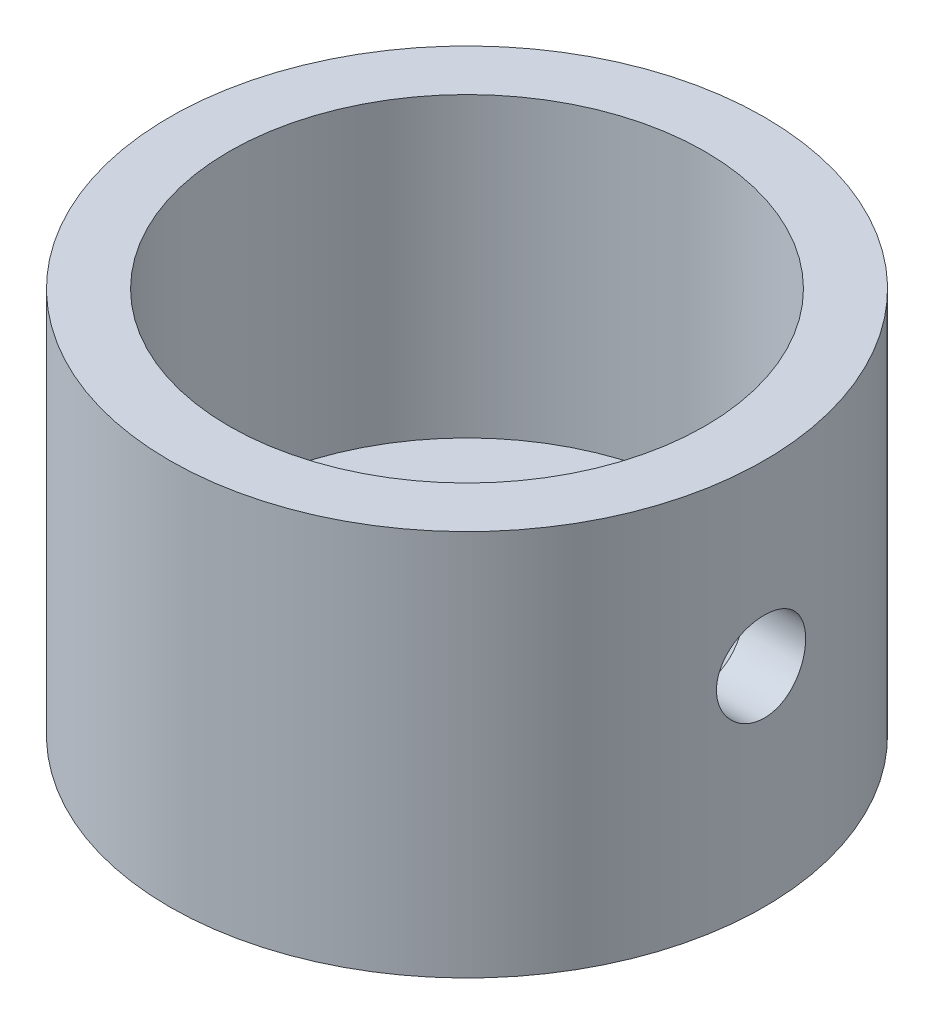
from build123d import *

# Parameters (mm, degrees)
SKETCH1_R           = 10
BOSS_EXTRUDE1_DEPTH = 3
SKETCH2_R           = 1.75
CUT_EXTRUDE1_DEPTH  = 3
SKETCH3_R           = 10
SKETCH3_R_2         = 8
BOSS_EXTRUDE2_DEPTH = 10
SKETCH4_R           = 1.5
CUT_EXTRUDE2_DEPTH  = 5


with BuildPart() as part:
    # Sketch1 → Boss-Extrude1 (new body)
    with BuildSketch(Plane(origin=(0, 0, 0), x_dir=(1, 0, 0), z_dir=(0, 1, 0))):
        with Locations(Location((0, 0, 0), (0, 0, 270))):
            Circle(SKETCH1_R)
    extrude(amount=BOSS_EXTRUDE1_DEPTH)

    # Sketch2 → Cut-Extrude1 (cut)
    with BuildSketch(Plane(origin=(0, 3, 0), x_dir=(1, 0, 0), z_dir=(0, 1, 0))):
        with Locations(Location((0, 0, 0), (0, 0, 270))):
            Circle(SKETCH2_R)
    extrude(amount=-CUT_EXTRUDE1_DEPTH, mode=Mode.SUBTRACT)

    # Sketch3 → Boss-Extrude2 (add)
    with BuildSketch(Plane(origin=(0, 3, 0), x_dir=(1, 0, 0), z_dir=(0, 1, 0))):
        with Locations(Location((0, 0, 0), (0, 0, 270))):
            Circle(SKETCH3_R)
        with Locations(Location((0, 0, 0), (0, 0, 270))):
            Circle(SKETCH3_R_2, mode=Mode.SUBTRACT)
    extrude(amount=BOSS_EXTRUDE2_DEPTH)

    # Sketch4 → Cut-Extrude2 (cut)
    with BuildSketch(Plane(origin=(10, 0, 0), x_dir=(0, 0, -1), z_dir=(1, 0, 0))):
        with Locations((0, 7)):
            Circle(SKETCH4_R)
    extrude(amount=-CUT_EXTRUDE2_DEPTH, mode=Mode.SUBTRACT)


solid = part.part
